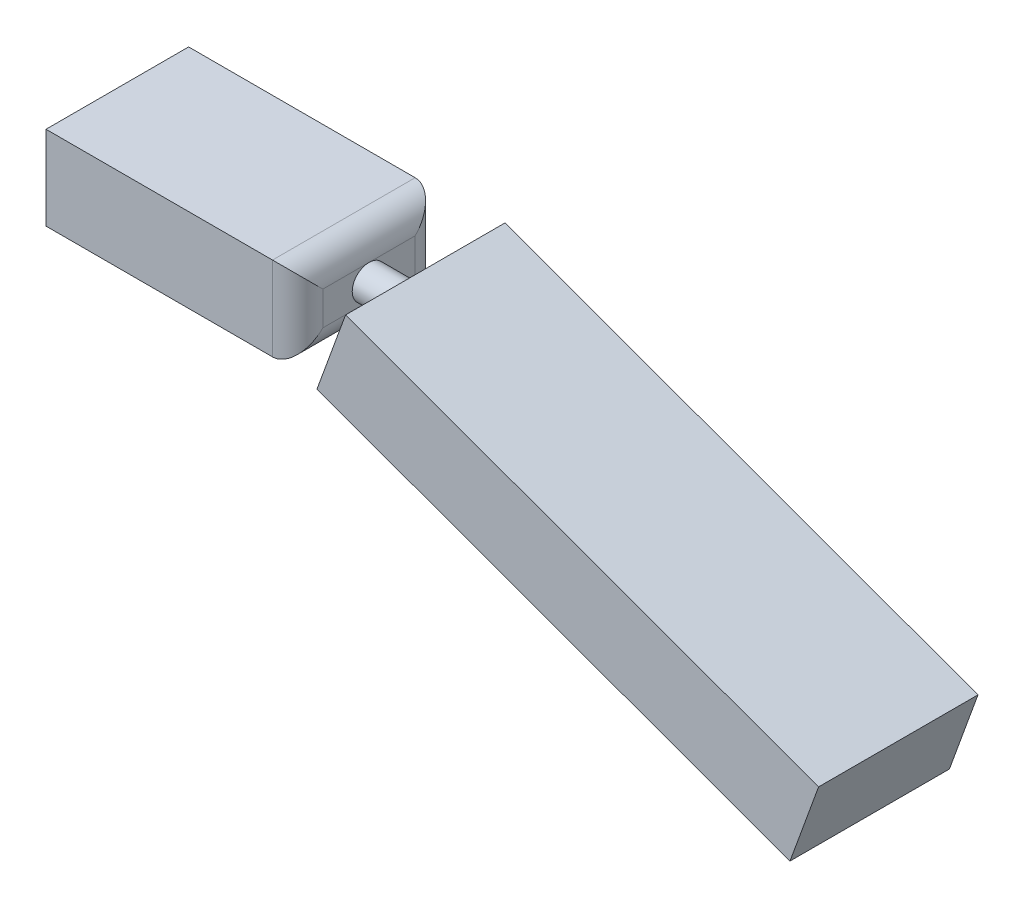
from build123d import *

# Parameters (mm, degrees)
SKETCH_1_W           = 30
SKETCH_1_H           = 17
EXTRUDE_1_DEPTH      = 10
SKETCH_2_W           = 14
SKETCH_2_H           = 7
CUT_EXTRUDE_1_DEPTH  = 12
FILLET_1_R           = 3
SKETCH_4_R           = 2
EXTRUDE_2_DEPTH      = 5
EXTRUDE_3_DEPTH      = 1
EXTRUDE_3_DEPTH_BACK = 18


with BuildPart() as part:
    # 草图1 → 凸台-拉伸1 (new body)
    with BuildSketch(Plane(origin=(0, 0, 0), x_dir=(1, 0, 0), z_dir=(0, 1, 0))):
        with Locations((15, 8.5)):
            Rectangle(SKETCH_1_W, SKETCH_1_H)
    extrude(amount=EXTRUDE_1_DEPTH)

    # 草图2 → 切除-拉伸1 (cut)
    with BuildSketch(Plane.ZY):
        with Locations((-8.5, 5)):
            Rectangle(SKETCH_2_W, SKETCH_2_H)
    extrude(amount=-CUT_EXTRUDE_1_DEPTH, mode=Mode.SUBTRACT)

    # 圆角1
    fillet_1_edges = [part.edges().sort_by_distance(p)[0] for p in [
        (30, 10, -8.5),
        (30, 0, -8.5),
        (30, 5, -17),
        (30, 5, 0),
    ]]
    fillet(fillet_1_edges, radius=FILLET_1_R)

    # 草图4 → 凸台-拉伸2 (add)
    with BuildSketch(Plane(origin=(30, 0, 0), x_dir=(0, 0, -1), z_dir=(1, 0, 0))):
        with Locations(Location((8.5, 5, 0), (0, 0, 270))):
            Circle(SKETCH_4_R)
    extrude(amount=EXTRUDE_2_DEPTH)

    # 草图5 → 凸台-拉伸3 (add, two sides: drawn at the far end of the back side and taken through both)
    with BuildSketch(Plane.XY.offset(-EXTRUDE_3_DEPTH_BACK)):
        Polygon((36.704530888, 9.683160127), (33.295469112, 0.316839873), (89.677026359, -20.204368726), (93.086088136, -10.838048473), align=None)
    extrude(amount=EXTRUDE_3_DEPTH + EXTRUDE_3_DEPTH_BACK)


solid = part.part
